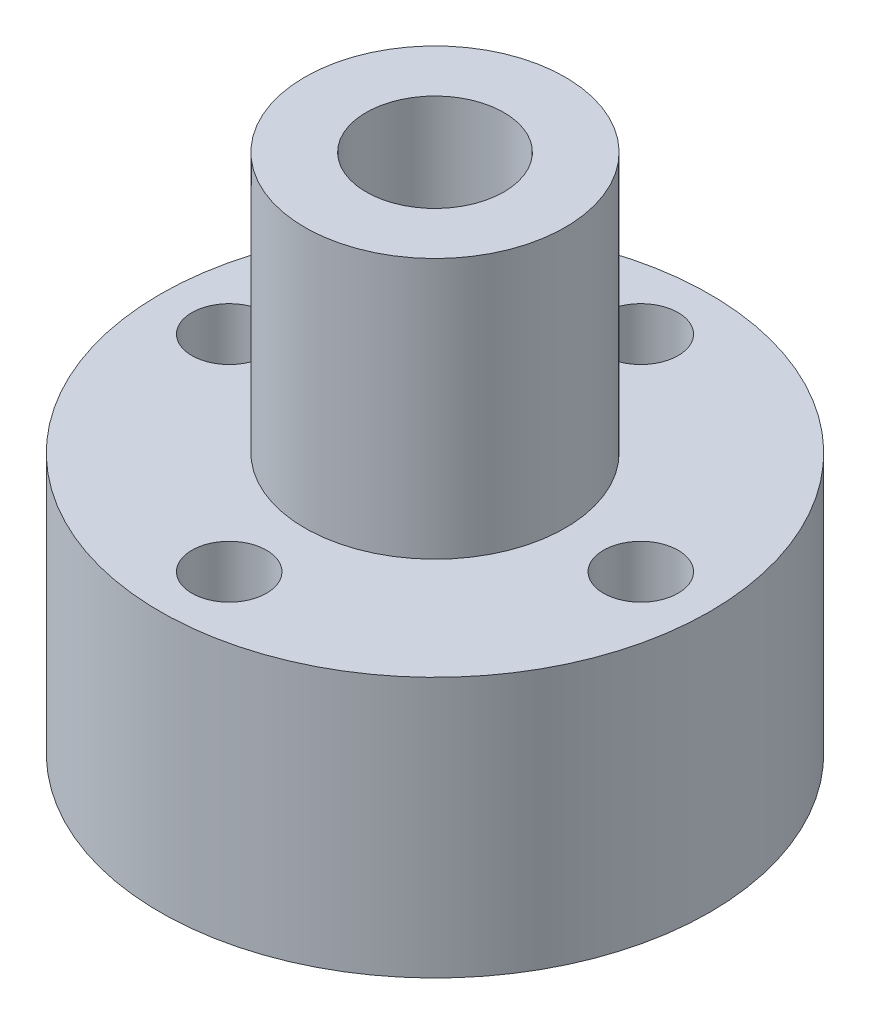
from build123d import *

# Parameters (mm, degrees)
CUT_EXTRUDE1_REACH = 46.922
SKETCH2_R          = 4.7625
SKETCH3_R          = 2.58
CUT_EXTRUDE2_DEPTH = 45.92215489


with BuildPart() as part:
    # Sketch1 → Revolve1 (revolve)
    with BuildSketch(Plane.XY, mode=Mode.PRIVATE) as revolve1_sk:
        Polygon((0, 0), (19, 0), (19, 18), (9, 18), (9, 36), (0, 36), align=None)
    revolve(revolve1_sk.sketch.rotate(Axis((0, 36, 0), (0, -1, 0)), 180), axis=Axis((0, 36, 0), (0, -1, 0)))

    # Sketch2 → Cut-Extrude1 (cut, up to next)
    with BuildSketch(Plane.XZ, mode=Mode.PRIVATE) as cut_extrude1_sk1:
        Circle(SKETCH2_R)
    cut_extrude1_tool1 = extrude(cut_extrude1_sk1.sketch, amount=-CUT_EXTRUDE1_REACH, mode=Mode.PRIVATE) & part.part
    add(cut_extrude1_tool1.solids().sort_by_distance((0, 0, 0))[0], mode=Mode.SUBTRACT)

    # Sketch3 → Cut-Extrude2 (cut, through all)
    with BuildSketch(Plane.XZ):
        with Locations((0, 14.225)):
            Circle(SKETCH3_R)
        with Locations((14.225, 0)):
            Circle(SKETCH3_R)
        with Locations((0, -14.225)):
            Circle(SKETCH3_R)
        with Locations((-14.225, 0)):
            Circle(SKETCH3_R)
    extrude(amount=-CUT_EXTRUDE2_DEPTH, mode=Mode.SUBTRACT)


solid = part.part
